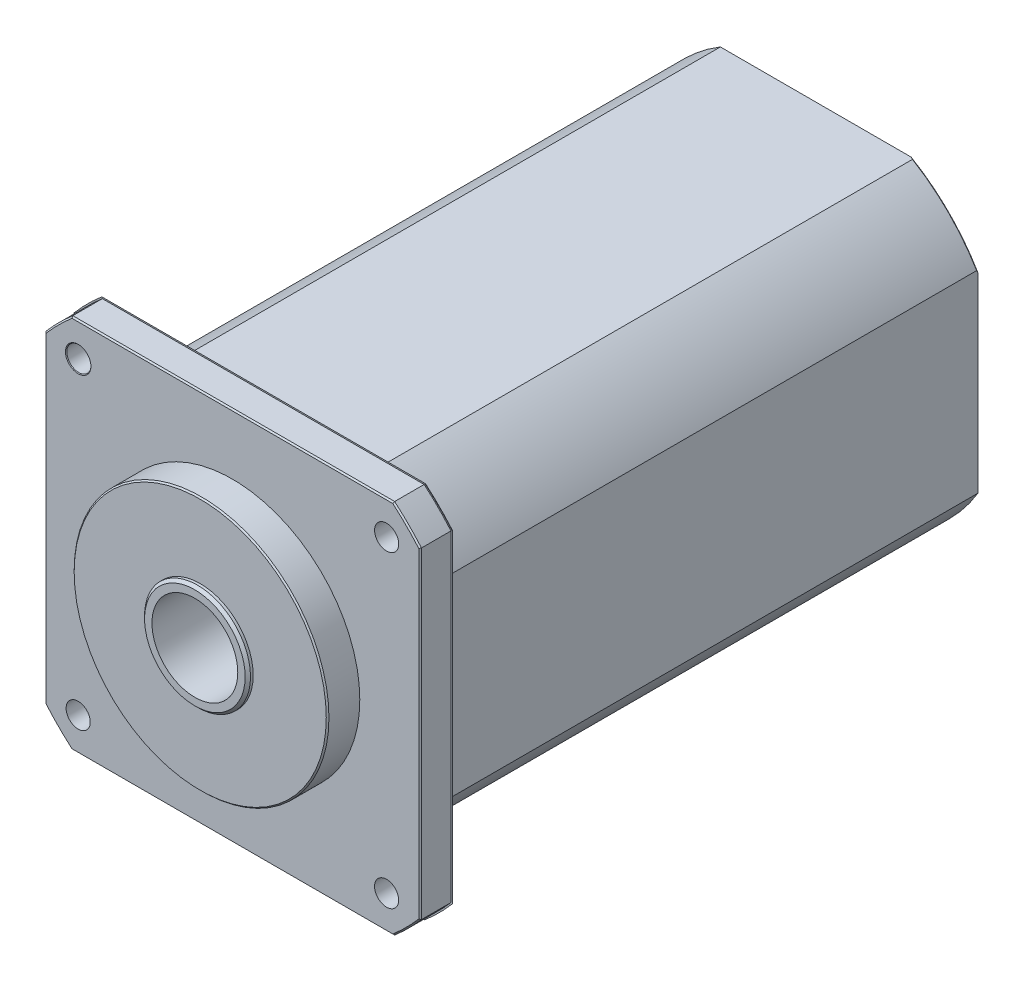
from build123d import *

# Parameters (mm, degrees)
BOSS_EXTRUDE10_DEPTH     = 0.5
BOSS_EXTRUDE10_DRAFT     = 45
BOSS_EXTRUDE11_DEPTH     = 11.499997616
SKETCH19_R               = 47.5
BOSS_EXTRUDE12_DEPTH     = 12.000000954
SKETCH20_R               = 19.75
BOSS_EXTRUDE13_DEPTH     = 1
SKETCH21_R               = 19.75
BOSS_EXTRUDE14_DEPTH     = 1
BOSS_EXTRUDE14_TAPER     = 45
SKETCH22_R               = 16
BOSS_EXTRUDE15_DEPTH     = 50
SKETCH28_R               = 57
BOSS_EXTRUDE17_DEPTH     = 0.5
BOSS_EXTRUDE17_DRAFT     = -45
BOSS_EXTRUDE18_DEPTH     = 205.500001907
F_9_0_9_DIAMETER_HOLE2_D = 9
CHAMFER5_SIZE            = 0.5
CHAMFER6_SIZE            = 0.25
SKETCH32_R               = 16
CUT_EXTRUDE1_DEPTH       = 311.604659233


with BuildPart() as part:
    # Sketch17 → Boss-Extrude10 (with draft: the straight prism first)
    with BuildSketch(Plane(origin=(0, 0, 15.249999762), x_dir=(-1, 0, 0), z_dir=(0, 0, -1))):
        with BuildLine():
            Line((-68.758451007, -77.559925727), (51.241548993, -77.559925727))
            ThreePointArc((51.241548993, -77.559925727), (56.433573045, -72.751949779), (61.241548993, -67.559925727))
            Line((61.241548993, -67.559925727), (61.241548993, 52.440074273))
            ThreePointArc((61.241548993, 52.440074273), (56.433573045, 57.632098325), (51.241548993, 62.440074273))
            Line((51.241548993, 62.440074273), (-68.758451007, 62.440074273))
            ThreePointArc((-68.758451007, 62.440074273), (-73.950475059, 57.632098325), (-78.758451007, 52.440074273))
            Line((-78.758451007, 52.440074273), (-78.758451007, -67.559925727))
            ThreePointArc((-78.758451007, -67.559925727), (-73.950475059, -72.751949779), (-68.758451007, -77.559925727))
        make_face()
    extrude(amount=-BOSS_EXTRUDE10_DEPTH)
    # Boss-Extrude10: the draft: its side faces are tilted about the plane it starts from
    boss_extrude10_sides = [part.faces().sort_by_distance(p)[0] for p in [
        (8.758451007, -77.559925727, 15.499999762),
        (-56.433573045, -72.751949779, 15.499999762),
        (-61.241548993, -7.559925727, 15.499999762),
        (-56.433573045, 57.632098325, 15.499999762),
        (8.758451007, 62.440074273, 15.499999762),
        (73.950475059, 57.632098325, 15.499999762),
        (78.758451007, -7.559925727, 15.499999762),
        (73.950475059, -72.751949779, 15.499999762),
    ]]
    draft(boss_extrude10_sides, Plane(origin=(0, 0, 15.249999762), x_dir=(-1, 0, 0), z_dir=(0, 0, -1)), BOSS_EXTRUDE10_DRAFT)

    # Sketch18 → Boss-Extrude11 (add)
    with BuildSketch(Plane.XY.offset(15.749999762)):
        with BuildLine():
            Line((-51.241548993, 62.440074273), (68.758451007, 62.440074273))
            ThreePointArc((68.758451007, 62.440074273), (73.950475059, 57.632098325), (78.758451007, 52.440074273))
            Line((78.758451007, 52.440074273), (78.758451007, -67.559925727))
            ThreePointArc((78.758451007, -67.559925727), (73.950475059, -72.751949779), (68.758451007, -77.559925727))
            Line((68.758451007, -77.559925727), (-51.241548993, -77.559925727))
            ThreePointArc((-51.241548993, -77.559925727), (-56.433573045, -72.751949779), (-61.241548993, -67.559925727))
            Line((-61.241548993, -67.559925727), (-61.241548993, 52.440074273))
            ThreePointArc((-61.241548993, 52.440074273), (-56.433573045, 57.632098325), (-51.241548993, 62.440074273))
        make_face()
    extrude(amount=BOSS_EXTRUDE11_DEPTH)

    # Sketch19 → Boss-Extrude12 (add)
    with BuildSketch(Plane.XY.offset(27.249997377)):
        with Locations((8.758451007, -7.559925727)):
            Circle(SKETCH19_R)
    extrude(amount=BOSS_EXTRUDE12_DEPTH)

    # Sketch20 → Boss-Extrude13 (add)
    with BuildSketch(Plane.XY.offset(39.249998331)):
        with Locations((8.758451007, -7.559925727)):
            Circle(SKETCH20_R)
    extrude(amount=BOSS_EXTRUDE13_DEPTH)

    # Sketch21 → Boss-Extrude14 (add)
    with BuildSketch(Plane.XY.offset(40.249998331)):
        with Locations((8.758451007, -7.559925727)):
            Circle(SKETCH21_R)
    extrude(amount=BOSS_EXTRUDE14_DEPTH, taper=BOSS_EXTRUDE14_TAPER)

    # Sketch22 → Boss-Extrude15 (add)
    with BuildSketch(Plane.XY.offset(41.249998331)):
        with Locations((8.758451007, -7.559925727)):
            Circle(SKETCH22_R)
    extrude(amount=BOSS_EXTRUDE15_DEPTH)


with BuildPart() as boss_extrude17_tool:
    # Sketch28 → Boss-Extrude17 (with draft: the straight prism first)
    with BuildSketch(Plane(origin=(0, 0, 15.249999762), x_dir=(-1, 0, 0), z_dir=(0, 0, -1))):
        with Locations((-8.758451007, -7.559925727)):
            Circle(SKETCH28_R)
    extrude(amount=BOSS_EXTRUDE17_DEPTH)
    # Boss-Extrude17: the draft: its side faces are tilted about the plane it starts from
    boss_extrude17_sides = [boss_extrude17_tool.faces().sort_by_distance(p)[0] for p in [
        (65.758451007, -7.559925727, 14.999999762),
    ]]
    draft(boss_extrude17_sides, Plane(origin=(0, 0, 15.249999762), x_dir=(-1, 0, 0), z_dir=(0, 0, -1)), BOSS_EXTRUDE17_DRAFT)


with BuildPart() as part_1:
    add(part.part)

    # Boss-Extrude17: add boss_extrude17_tool
    add(boss_extrude17_tool.part)

    # Sketch29 → Boss-Extrude18 (add)
    with BuildSketch(Plane(origin=(0, 0, 14.749999762), x_dir=(-1, 0, 0), z_dir=(0, 0, -1))):
        with BuildLine():
            Line((-44.813963761, -67.559925727), (27.297061748, -67.559925727))
            ThreePointArc((27.297061748, -67.559925727), (40.739023677, -57.05740041), (51.241548993, -43.615438482))
            Line((51.241548993, -43.615438482), (51.241548993, 28.495587027))
            ThreePointArc((51.241548993, 28.495587027), (40.739023677, 41.937548956), (27.297061748, 52.440074273))
            Line((27.297061748, 52.440074273), (-44.813963761, 52.440074273))
            ThreePointArc((-44.813963761, 52.440074273), (-58.25592569, 41.937548956), (-68.758451007, 28.495587027))
            Line((-68.758451007, 28.495587027), (-68.758451007, -43.615438482))
            ThreePointArc((-68.758451007, -43.615438482), (-58.25592569, -57.05740041), (-44.813963761, -67.559925727))
        make_face()
    extrude(amount=BOSS_EXTRUDE18_DEPTH)

    # Ø9.0 (9) Diameter Hole2 (through all)
    with Locations(Plane(origin=(0, 0, 15.249999762), x_dir=(-1, 0, 0), z_dir=(0, 0, -1))):
        with Locations((48.741548993, 49.940074273), (-66.258451007, 49.940074273), (-66.258451007, -65.059925727), (48.741548993, -65.059925727)):
            Hole(F_9_0_9_DIAMETER_HOLE2_D / 2)

    # Chamfer5
    chamfer5_edges = [part_1.edges().sort_by_distance(p)[0] for p in [
        (-53.241548993, 49.940074273, 15.249999762),
        (-56.433573045, 57.632098325, 27.249997377),
        (-61.241548993, -7.559925727, 27.249997377),
        (-56.433573045, -72.751949779, 27.249997377),
        (8.758451007, -77.559925727, 27.249997377),
        (73.950475059, -72.751949779, 27.249997377),
        (78.758451007, -7.559925727, 27.249997377),
        (73.950475059, 57.632098325, 27.249997377),
        (8.758451007, 62.440074273, 27.249997377),
        (-38.741548993, -7.559925727, 39.249998331),
        (58.25592569, 41.937548956, -190.750002146),
    ]]
    chamfer(chamfer5_edges, length=CHAMFER5_SIZE)

    # Chamfer6
    chamfer6_edges = [part_1.edges().sort_by_distance(p)[0] for p in [
        (-53.241548993, 49.940074273, 27.249997377),
    ]]
    chamfer(chamfer6_edges, length=CHAMFER6_SIZE)

    # Sketch32 → Cut-Extrude1 (cut, through all)
    with BuildSketch(Plane.XY.offset(99.249998331)):
        with Locations((8.758451007, -7.559925727)):
            Circle(SKETCH32_R)
    extrude(amount=-CUT_EXTRUDE1_DEPTH, mode=Mode.SUBTRACT)


solid = part_1.part
